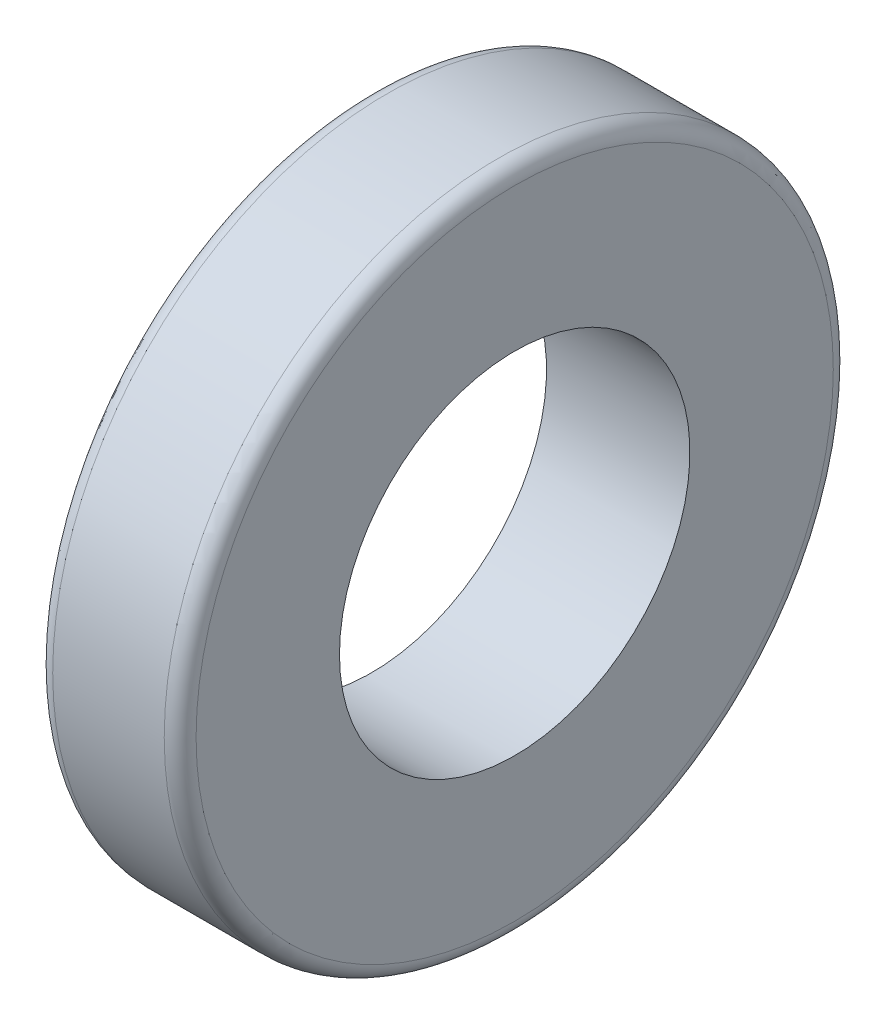
from build123d import *

# Parameters (mm, degrees)
SKETCH1_W = 4.5
SKETCH1_H = 5
FILLET1_R = 0.5


with BuildPart() as part:
    # Sketch1 → Revolve1 (revolve)
    with BuildSketch(Plane.XY, mode=Mode.PRIVATE) as revolve1_sk:
        with Locations((3, 8)):
            Rectangle(SKETCH1_W, SKETCH1_H)
    revolve(revolve1_sk.sketch.rotate(Axis((0, 0, 0), (1, 0, 0)), 90), axis=Axis((0, 0, 0), (1, 0, 0)))

    # Fillet1
    fillet1_edges = [part.edges().sort_by_distance(p)[0] for p in [
        (5.25, 0, -10.5),
        (0.75, 0, -10.5),
    ]]
    fillet(fillet1_edges, radius=FILLET1_R)


solid = part.part
